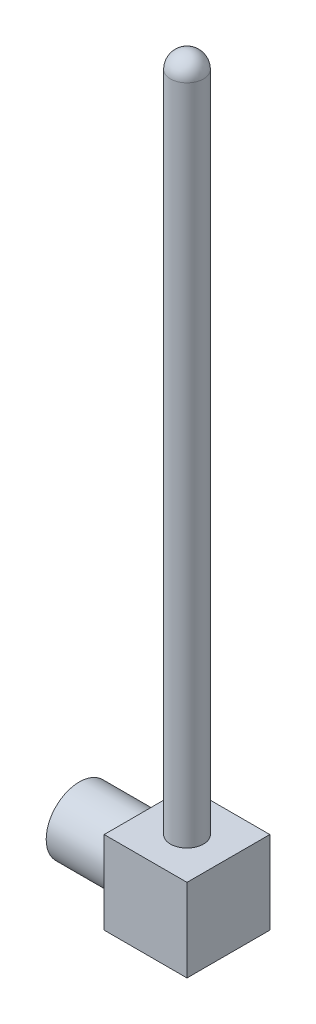
from build123d import *
from build123d.topology import SkipClean

# Parameters (mm, degrees)
SKETCH2_R           = 5
BOSS_EXTRUDE1_DEPTH = 200
SKETCH3_W           = 25
SKETCH3_H           = 25
BOSS_EXTRUDE2_DEPTH = 25
SKETCH4_R           = 10
BOSS_EXTRUDE3_DEPTH = 20


with BuildPart() as part:
    # Sketch2 → Boss-Extrude1 (new body)
    with BuildSketch(Plane(origin=(0, 0, 0), x_dir=(1, 0, 0), z_dir=(0, 1, 0))):
        with Locations(Location((0, 0, 0), (0, 0, 270))):
            Circle(SKETCH2_R)
    extrude(amount=BOSS_EXTRUDE1_DEPTH)

    # Sketch3 → Boss-Extrude2 (add)
    with BuildSketch(Plane.XZ):
        Rectangle(SKETCH3_W, SKETCH3_H)
    extrude(amount=BOSS_EXTRUDE2_DEPTH)

    # Sketch4 → Boss-Extrude3 (add)
    with BuildSketch(Plane.ZY.offset(12.5)):
        with Locations((0, -12.5)):
            Circle(SKETCH4_R)
    extrude(amount=BOSS_EXTRUDE3_DEPTH)

    # Sketch6 → Revolve2 (revolve)
    with SkipClean():  # the faces are left unmerged after this step: merging them gives an invalid solid
        with BuildSketch(Plane(origin=(0, 0, 0), x_dir=(0, 0, -1), z_dir=(1, 0, 0))):
            with BuildLine():
                Line((-5, 200), (5, 200))
                ThreePointArc((5, 200), (0, 205), (-5, 200))
            make_face()
        revolve(axis=Axis((0, 200, 5), (0, 0, -1)))


solid = part.part
